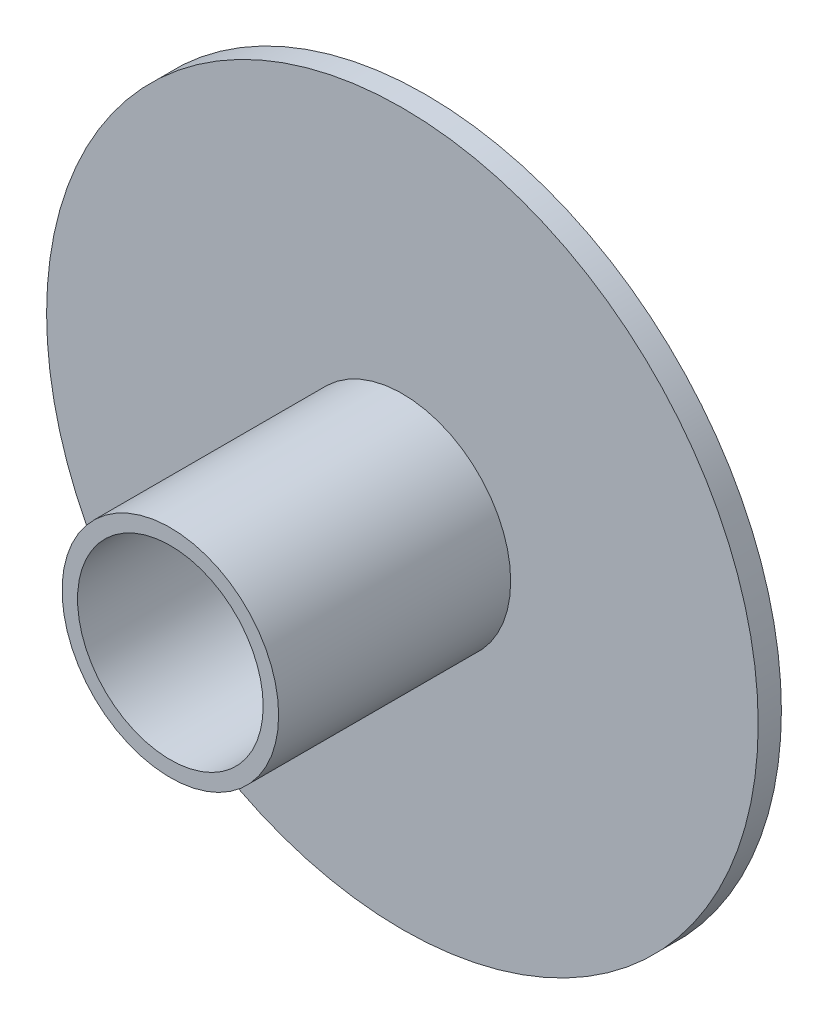
from build123d import *

# Parameters (mm, degrees)
SKETCH1_R               = 23
BOSS_EXTRUDE1_DEPTH     = 1.5
SKETCH2_R               = 7
BOSS_EXTRUDE2_DEPTH     = 15
CUT_EXTRUDE1_DEPTH      = 37.47259245
CUT_EXTRUDE1_DEPTH_BACK = 37.47259245
SKETCH3_R               = 6


with BuildPart() as part:
    # Sketch1 → Boss-Extrude1 (new body)
    with BuildSketch(Plane.XY):
        Circle(SKETCH1_R)
    extrude(amount=BOSS_EXTRUDE1_DEPTH)

    # Sketch2 → Boss-Extrude2 (add)
    with BuildSketch(Plane.XY.offset(1.5)):
        Circle(SKETCH2_R)
    extrude(amount=BOSS_EXTRUDE2_DEPTH)

    # Sketch3 → Cut-Extrude1 (cut, two sides: drawn at the far end of the back side and taken through both)
    with BuildSketch(Plane.XY.offset(16.5).offset(-CUT_EXTRUDE1_DEPTH_BACK)):
        Circle(SKETCH3_R)
    extrude(amount=CUT_EXTRUDE1_DEPTH + CUT_EXTRUDE1_DEPTH_BACK, mode=Mode.SUBTRACT)


solid = part.part
